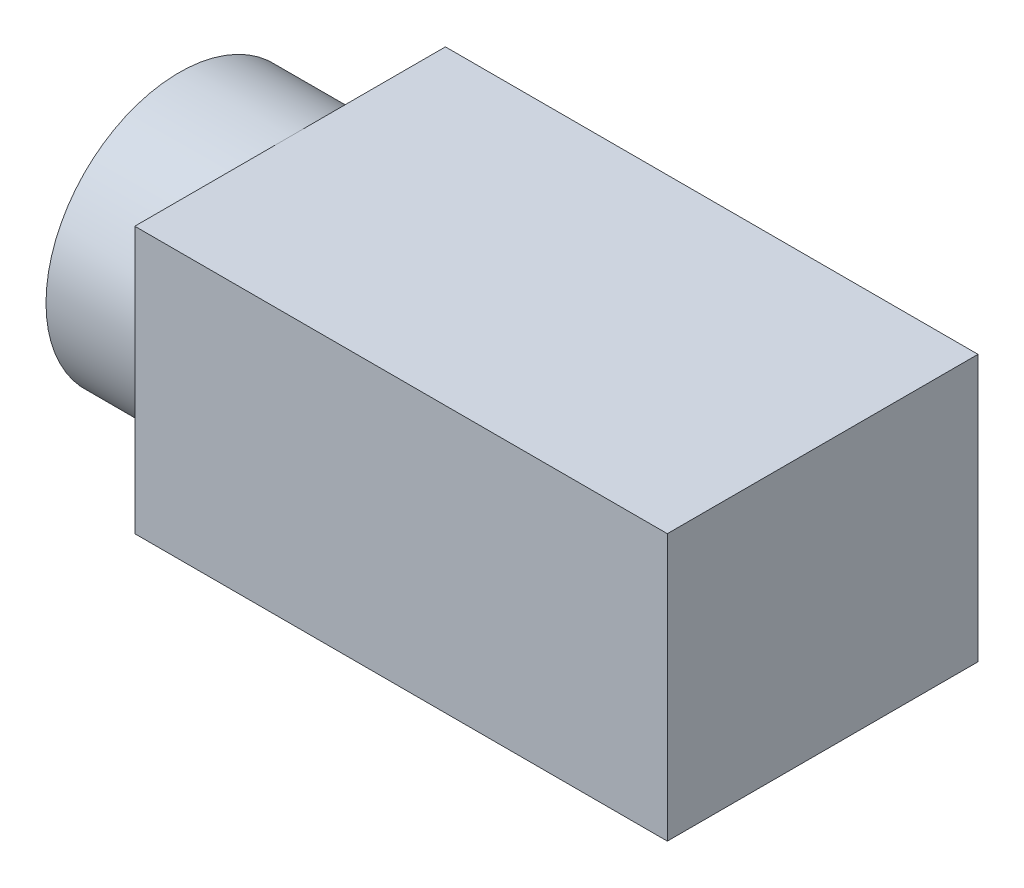
from build123d import *

# Parameters (mm, degrees)
SKETCH1_W           = 12
SKETCH1_H           = 6
BOSS_EXTRUDE1_DEPTH = 7
SKETCH2_R           = 3
BOSS_EXTRUDE2_DEPTH = 2.5
SKETCH3_R           = 0.5
BOSS_EXTRUDE3_DEPTH = 2.1
FILLET1_R           = 0.5


with BuildPart() as part:
    # Sketch1 → Boss-Extrude1 (new body)
    with BuildSketch(Plane.XY):
        with Locations((6, 3)):
            Rectangle(SKETCH1_W, SKETCH1_H)
    extrude(amount=BOSS_EXTRUDE1_DEPTH)

    # Sketch2 → Boss-Extrude2 (add)
    with BuildSketch(Plane.ZY):
        with Locations(Location((3.5, 3, 0), (0, 0, 270))):
            Circle(SKETCH2_R)
    extrude(amount=BOSS_EXTRUDE2_DEPTH)

    # Sketch3 → Boss-Extrude3 (add)
    with BuildSketch(Plane.XZ):
        with Locations(Location((2, 3.5, 0), (0, 0, 90))):
            Circle(SKETCH3_R)
        with Locations(Location((9, 3.5, 0), (0, 0, 90))):
            Circle(SKETCH3_R)
    extrude(amount=BOSS_EXTRUDE3_DEPTH)

    # Fillet1
    fillet1_edges = [part.edges().sort_by_distance(p)[0] for p in [
        (2, -2.1, 3),
        (9, -2.1, 3),
    ]]
    fillet(fillet1_edges, radius=FILLET1_R)


solid = part.part
